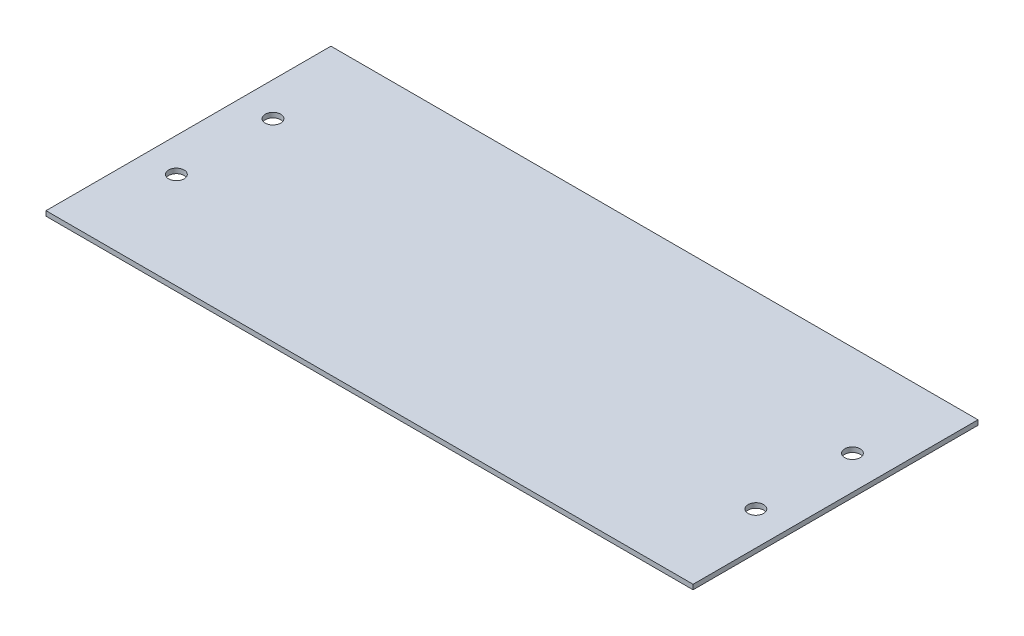
from build123d import *

# Parameters (mm, degrees)
SKETCH_1_W          = 134
SKETCH_1_H          = 59
EXTRUDE_1_DEPTH     = 1
SKETCH_2_R          = 1.6
CUT_EXTRUDE_1_DEPTH = 74.213728221


with BuildPart() as part:
    # 草图1 → 凸台-拉伸1 (new body)
    with BuildSketch(Plane(origin=(0, 0, 0), x_dir=(1, 0, 0), z_dir=(0, 1, 0))):
        Rectangle(SKETCH_1_W, SKETCH_1_H)
    extrude(amount=EXTRUDE_1_DEPTH)

    # 草图2 → 切除-拉伸1 (cut, through all)
    with BuildSketch(Plane(origin=(0, 1, 0), x_dir=(1, 0, 0), z_dir=(0, 1, 0))):
        with Locations(Location((-60, -9.5, 0), (0, 0, 270))):
            Circle(SKETCH_2_R)
        with Locations(Location((-60, 10.5, 0), (0, 0, 270))):
            Circle(SKETCH_2_R)
        with Locations(Location((60, 10.5, 0), (0, 0, 90))):
            Circle(SKETCH_2_R)
        with Locations(Location((60, -9.5, 0), (0, 0, 90))):
            Circle(SKETCH_2_R)
    extrude(amount=-CUT_EXTRUDE_1_DEPTH, mode=Mode.SUBTRACT)


solid = part.part
